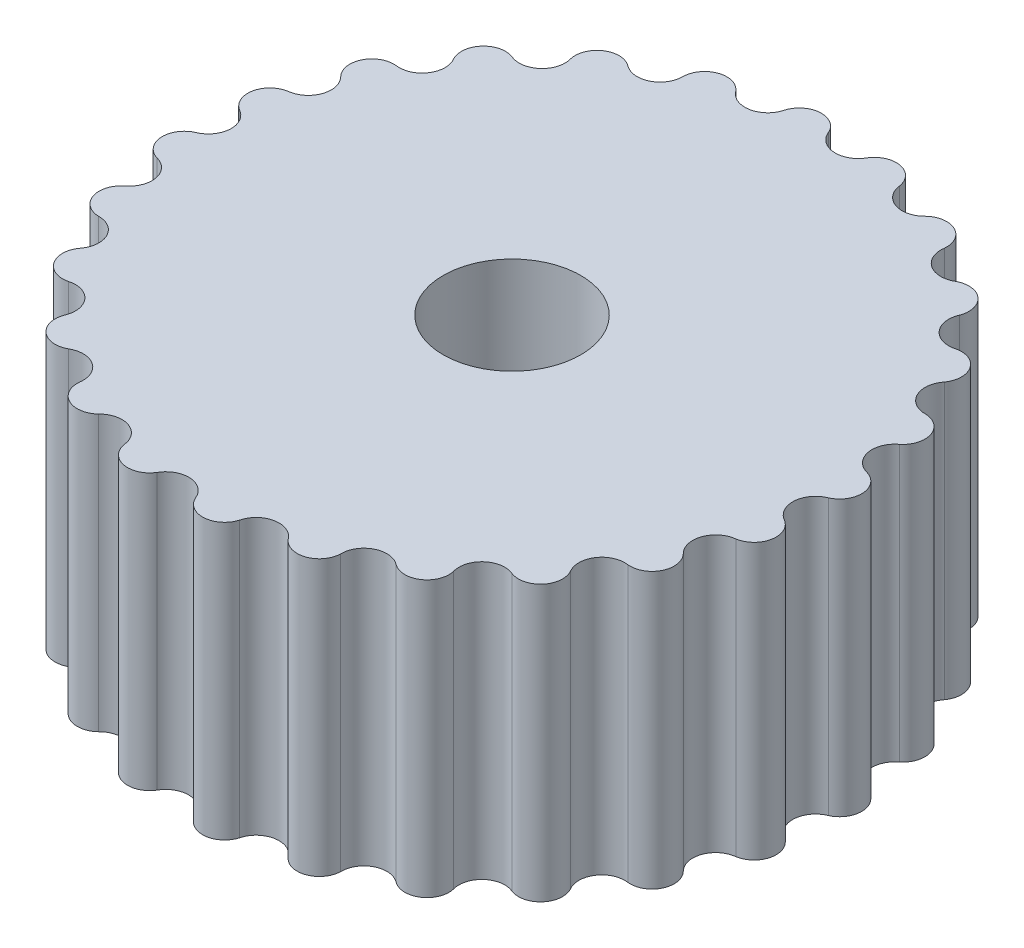
from build123d import *

# Parameters (mm, degrees)
BOSS_EXTRUDE1_DEPTH = 5
CIRPATTERN1_COUNT   = 24


with BuildPart() as part:
    # Sketch1 → Boss-Extrude1 (new body)
    with BuildSketch(Plane(origin=(0, 0, 0), x_dir=(1, 0, 0), z_dir=(0, 1, 0))):
        with BuildLine():
            Line((0, 5.75), (0, 1.25))
            ThreePointArc((0, 1.25), (0.16315774, 1.239306077), (0.323523806, 1.207407283))
            Line((0.323523806, 1.207407283), (1.488209509, 5.554073501))
            ThreePointArc((1.488209509, 5.554073501), (1.170541932, 5.884711682), (0.750525605, 5.700807953))
            ThreePointArc((0.750525605, 5.700807953), (0.359717211, 5.488224078), (0, 5.75))
        make_face()
    boss_extrude1 = extrude(amount=BOSS_EXTRUDE1_DEPTH)

    # CirPattern1: Boss-Extrude1 ×24 about axis
    cirpattern1_axis = Axis((0, 0, 0), (0, 1, 0))
    for i in range(1, CIRPATTERN1_COUNT):
        add(boss_extrude1.rotate(cirpattern1_axis, i * 360 / CIRPATTERN1_COUNT))


solid = part.part
